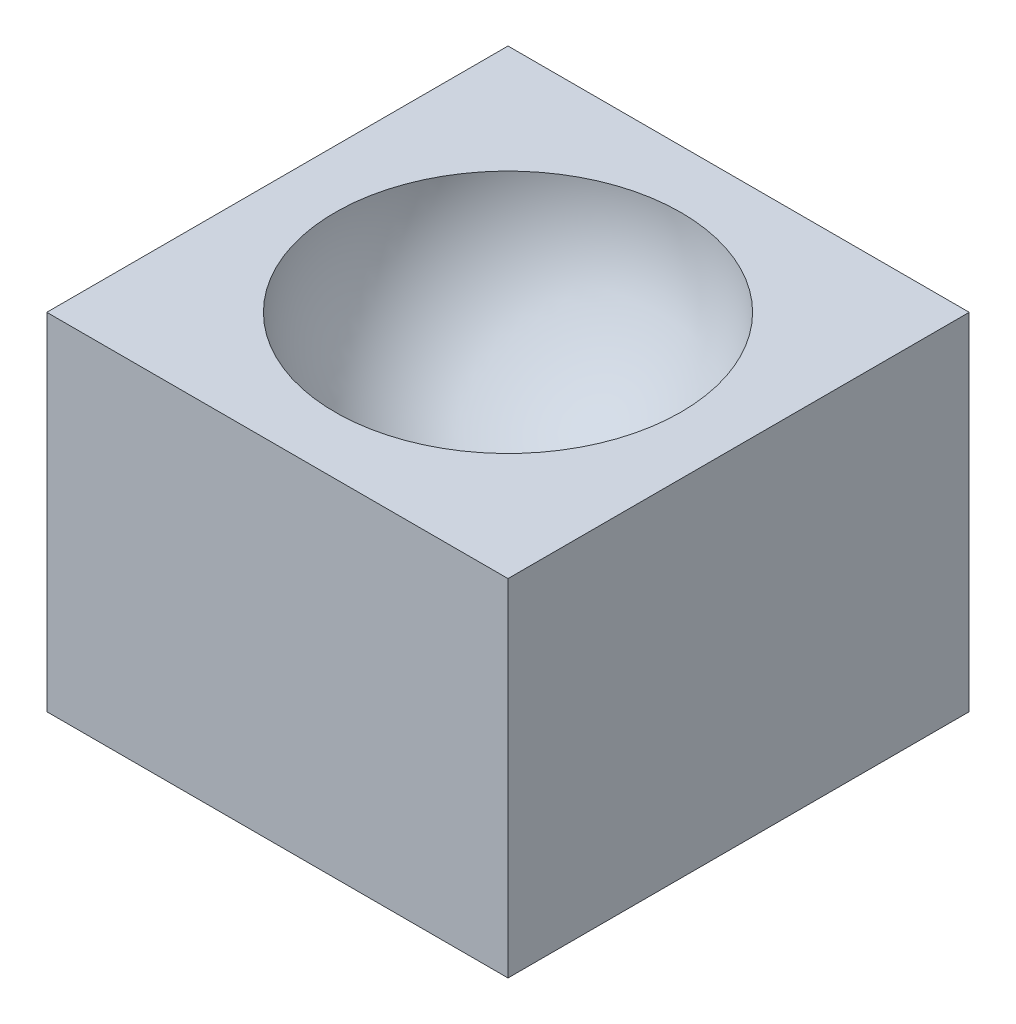
from build123d import *

# Parameters (mm, degrees)
SKETCH1_W           = 20
SKETCH1_H           = 20
BOSS_EXTRUDE1_DEPTH = 15
SKETCH5_R           = 4.2540047
CUT_EXTRUDE1_DEPTH  = 5


with BuildPart() as part:
    # Sketch1 → Boss-Extrude1 (new body)
    with BuildSketch(Plane(origin=(0, 0, 0), x_dir=(1, 0, 0), z_dir=(0, 1, 0))):
        with Locations((10, 10)):
            Rectangle(SKETCH1_W, SKETCH1_H)
    extrude(amount=BOSS_EXTRUDE1_DEPTH)

    # Sketch4 → Cut-Revolve7 (revolve, cut)
    with BuildSketch(Plane.XY.offset(-10)):
        with BuildLine():
            Line((10, 22.5), (10, 7.5))
            ThreePointArc((10, 7.5), (17.5, 15), (10, 22.5))
        make_face()
    revolve(axis=Axis((10, 22.5, -10), (0, -1, 0)), mode=Mode.SUBTRACT)

    # Sketch5 → Cut-Extrude1 (cut)
    with BuildSketch(Plane.XZ):
        with Locations(Location((10, -10, 0), (0, 0, 270))):
            Circle(SKETCH5_R)
    extrude(amount=-CUT_EXTRUDE1_DEPTH, mode=Mode.SUBTRACT)


solid = part.part
